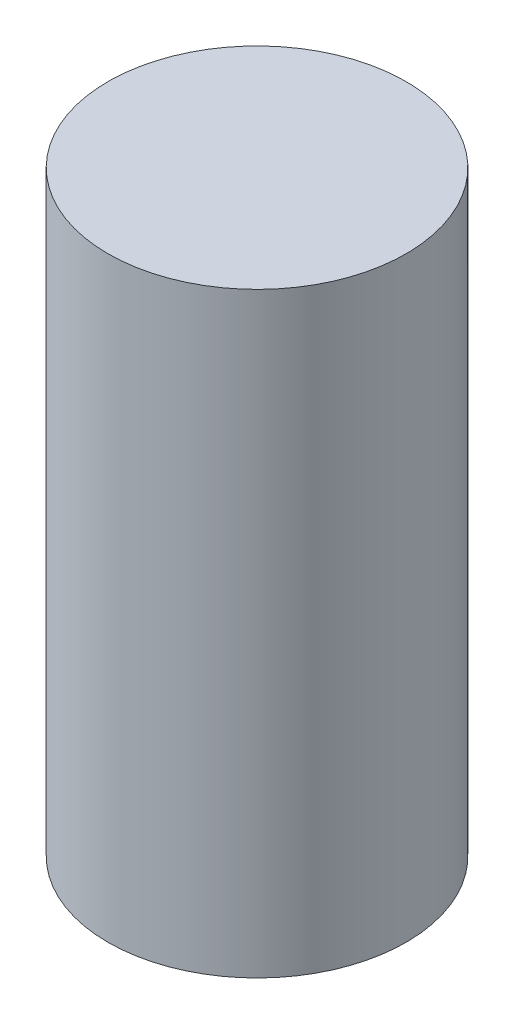
from build123d import *

# Parameters (mm, degrees)
SKETCH1_R           = 41.275
BOSS_EXTRUDE1_DEPTH = 165.1


with BuildPart() as part:
    # Sketch1 → Boss-Extrude1 (new body)
    with BuildSketch(Plane(origin=(0, 0, 0), x_dir=(1, 0, 0), z_dir=(0, 1, 0))):
        with Locations(Location((0, 0, 0), (0, 0, 270))):
            Circle(SKETCH1_R)
    extrude(amount=BOSS_EXTRUDE1_DEPTH)


solid = part.part
